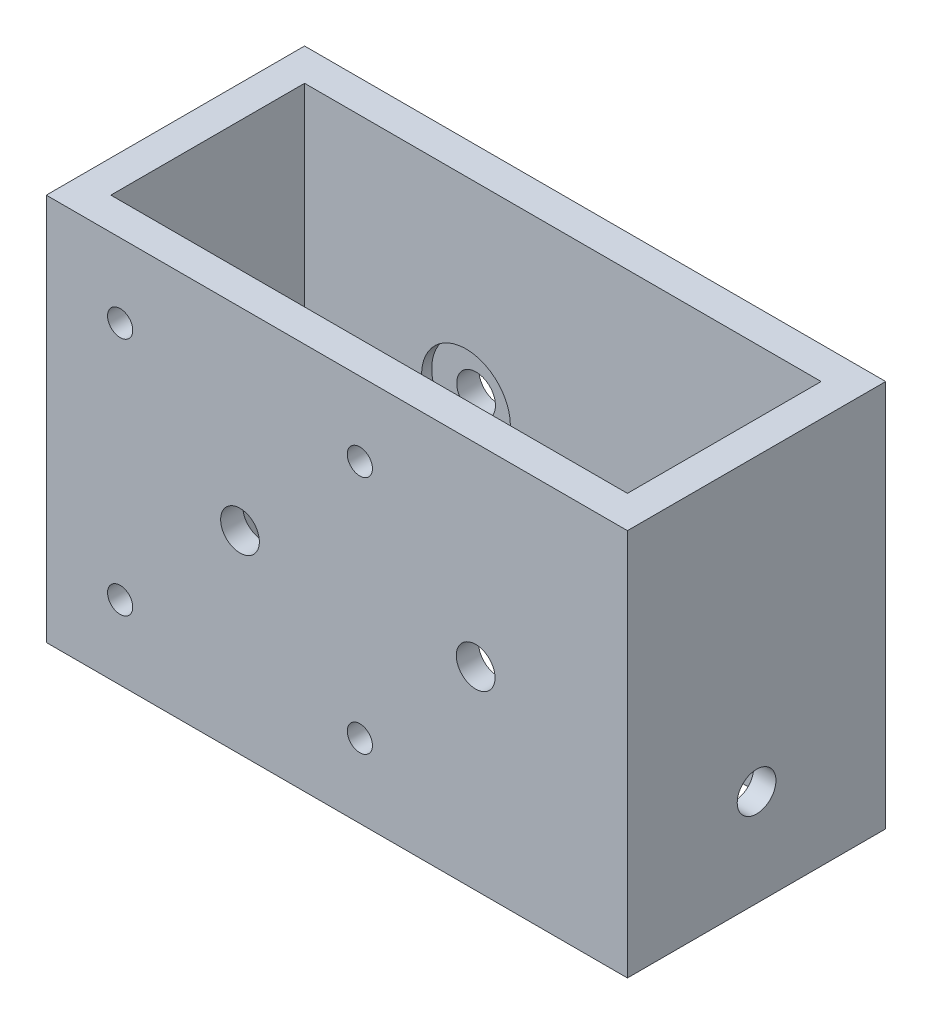
from build123d import *

# Parameters (mm, degrees)
SKETCH1_W           = 114.3
SKETCH1_H           = 50.8
SKETCH1_W_2         = 101.6
SKETCH1_H_2         = 38.1
BOSS_EXTRUDE1_DEPTH = 76.2
CUT_EXTRUDE1_REACH  = 148.464
SKETCH2_R           = 2.4765
SKETCH2_5_R         = 3.81
CUT_EXTRUDE2_DEPTH  = 147.463544952
SKETCH5_R           = 3.81
CUT_EXTRUDE4_DEPTH  = 147.463544952
SKETCH6_R           = 3.81
CUT_EXTRUDE5_DEPTH  = 147.463544952
SKETCH7_R           = 8.73125
CUT_EXTRUDE6_DEPTH  = 1.984375
SKETCH8_R           = 8.73125
CUT_EXTRUDE7_DEPTH  = 1.984375
CUT_EXTRUDE8_START  = -1.984375
SKETCH9_R           = 8.73125
CUT_EXTRUDE8_DEPTH  = 1.984375
CUT_EXTRUDE9_START  = -1.984375
SKETCH10_R          = 8.73125
CUT_EXTRUDE9_DEPTH  = 1.984375


with BuildPart() as part:
    # Sketch1 → Boss-Extrude1 (new body)
    with BuildSketch(Plane(origin=(0, 0, 0), x_dir=(1, 0, 0), z_dir=(0, 1, 0))):
        with Locations((57.15, -25.4)):
            Rectangle(SKETCH1_W, SKETCH1_H)
        with Locations((57.15, -25.4)):
            Rectangle(SKETCH1_W_2, SKETCH1_H_2, mode=Mode.SUBTRACT)
    extrude(amount=BOSS_EXTRUDE1_DEPTH)

    # Sketch2 → Cut-Extrude1 (cut, up to next)
    with BuildSketch(Plane.XY.offset(50.8), mode=Mode.PRIVATE) as cut_extrude1_sk1:
        with Locations((14.526827682, 61.673172318)):
            Circle(SKETCH2_R)
    cut_extrude1_tool1 = extrude(cut_extrude1_sk1.sketch, amount=-CUT_EXTRUDE1_REACH, mode=Mode.PRIVATE) & part.part
    # Sketch2 → Cut-Extrude1 (cut, up to next)
    with BuildSketch(Plane.XY.offset(50.8), mode=Mode.PRIVATE) as cut_extrude1_sk2:
        with Locations((61.673172318, 61.673172318)):
            Circle(SKETCH2_R)
    cut_extrude1_tool2 = extrude(cut_extrude1_sk2.sketch, amount=-CUT_EXTRUDE1_REACH, mode=Mode.PRIVATE) & part.part
    # Sketch2 → Cut-Extrude1 (cut, up to next)
    with BuildSketch(Plane.XY.offset(50.8), mode=Mode.PRIVATE) as cut_extrude1_sk3:
        with Locations((61.673172318, 14.526827682)):
            Circle(SKETCH2_R)
    cut_extrude1_tool3 = extrude(cut_extrude1_sk3.sketch, amount=-CUT_EXTRUDE1_REACH, mode=Mode.PRIVATE) & part.part
    # Sketch2 → Cut-Extrude1 (cut, up to next)
    with BuildSketch(Plane.XY.offset(50.8), mode=Mode.PRIVATE) as cut_extrude1_sk4:
        with Locations((14.526827682, 14.526827682)):
            Circle(SKETCH2_R)
    cut_extrude1_tool4 = extrude(cut_extrude1_sk4.sketch, amount=-CUT_EXTRUDE1_REACH, mode=Mode.PRIVATE) & part.part
    add(cut_extrude1_tool1.solids().sort_by_distance((14.526828, 61.673172, 50.8))[0], mode=Mode.SUBTRACT)
    add(cut_extrude1_tool2.solids().sort_by_distance((61.673172, 61.673172, 50.8))[0], mode=Mode.SUBTRACT)
    add(cut_extrude1_tool3.solids().sort_by_distance((61.673172, 14.526828, 50.8))[0], mode=Mode.SUBTRACT)
    add(cut_extrude1_tool4.solids().sort_by_distance((14.526828, 14.526828, 50.8))[0], mode=Mode.SUBTRACT)

    # Sketch2<5> → Cut-Extrude2 (cut, through all)
    with BuildSketch(Plane.XY.offset(50.8)):
        with Locations((38.1, 38.1)):
            Circle(SKETCH2_5_R)
    extrude(amount=-CUT_EXTRUDE2_DEPTH, mode=Mode.SUBTRACT)

    # Sketch5 → Cut-Extrude4 (cut, through all)
    with BuildSketch(Plane.XY.offset(50.8)):
        with Locations((84.455, 38.1)):
            Circle(SKETCH5_R)
    extrude(amount=-CUT_EXTRUDE4_DEPTH, mode=Mode.SUBTRACT)

    # Sketch6 → Cut-Extrude5 (cut, through all)
    with BuildSketch(Plane.ZY):
        with Locations((25.4, 19.05)):
            Circle(SKETCH6_R)
    extrude(amount=-CUT_EXTRUDE5_DEPTH, mode=Mode.SUBTRACT)

    # Sketch7 → Cut-Extrude6 (cut)
    with BuildSketch(Plane(origin=(6.35, 0, 0), x_dir=(0, 0, -1), z_dir=(1, 0, 0))):
        with Locations((-25.4, 19.05)):
            Circle(SKETCH7_R)
    extrude(amount=-CUT_EXTRUDE6_DEPTH, mode=Mode.SUBTRACT)

    # Sketch8 → Cut-Extrude7 (cut)
    with BuildSketch(Plane(origin=(0, 0, 44.45), x_dir=(-1, 0, 0), z_dir=(0, 0, -1))):
        with Locations((-38.1, 38.1)):
            Circle(SKETCH8_R)
        with Locations((-84.455, 38.1)):
            Circle(SKETCH8_R)
    extrude(amount=-CUT_EXTRUDE7_DEPTH, mode=Mode.SUBTRACT)

    # Sketch9 → Cut-Extrude8 (cut)
    with BuildSketch(Plane.ZY.offset(-107.95).offset(CUT_EXTRUDE8_START)):
        with Locations((25.4, 19.05)):
            Circle(SKETCH9_R)
    extrude(amount=CUT_EXTRUDE8_DEPTH, mode=Mode.SUBTRACT)

    # Sketch10 → Cut-Extrude9 (cut)
    with BuildSketch(Plane.XY.offset(6.35).offset(CUT_EXTRUDE9_START)):
        with Locations((38.1, 38.1)):
            Circle(SKETCH10_R)
        with Locations((84.455, 38.1)):
            Circle(SKETCH10_R)
    extrude(amount=CUT_EXTRUDE9_DEPTH, mode=Mode.SUBTRACT)


solid = part.part
